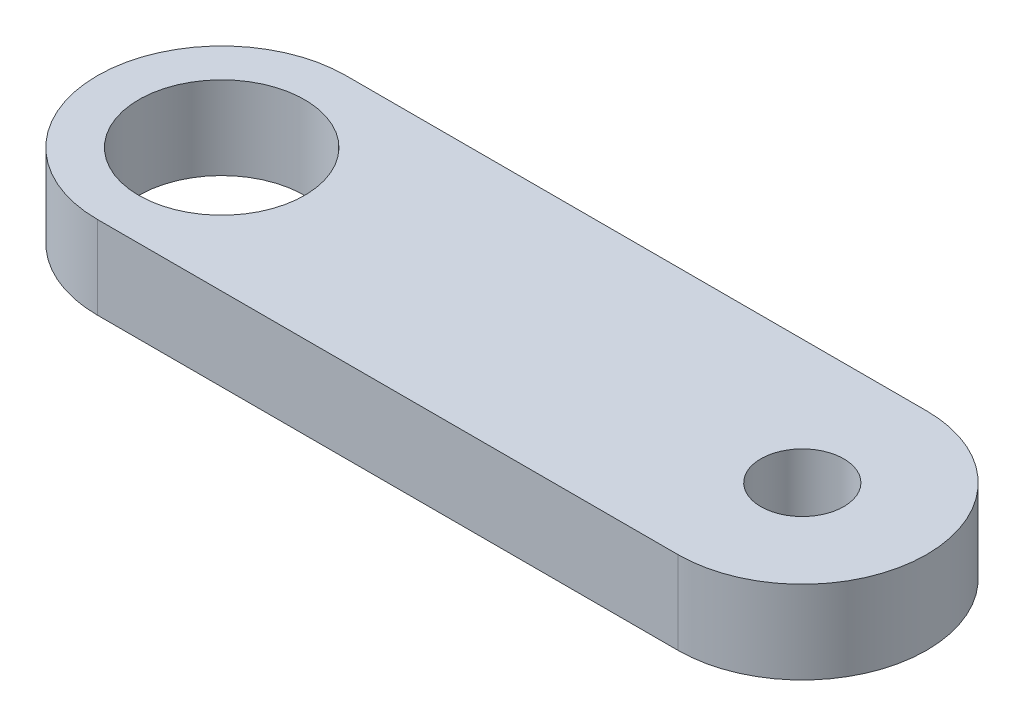
from build123d import *

# Parameters (mm, degrees)
SKETCH1_R           = 2.5
SKETCH1_R_2         = 5
BOSS_EXTRUDE1_DEPTH = 5


with BuildPart() as part:
    # Sketch1 → Boss-Extrude1 (new body)
    with BuildSketch(Plane(origin=(0, 0, 0), x_dir=(1, 0, 0), z_dir=(0, 1, 0))):
        with BuildLine():
            Line((0, 0), (35, 0))
            ThreePointArc((35, 0), (42.5, 7.5), (35, 15))
            Line((35, 15), (0, 15))
            ThreePointArc((0, 15), (-7.5, 7.5), (0, 0))
        make_face()
        with Locations(Location((35, 7.5, 0), (0, 0, 270))):
            Circle(SKETCH1_R, mode=Mode.SUBTRACT)
        with Locations(Location((0, 7.5, 0), (0, 0, 270))):
            Circle(SKETCH1_R_2, mode=Mode.SUBTRACT)
    extrude(amount=BOSS_EXTRUDE1_DEPTH)


solid = part.part
